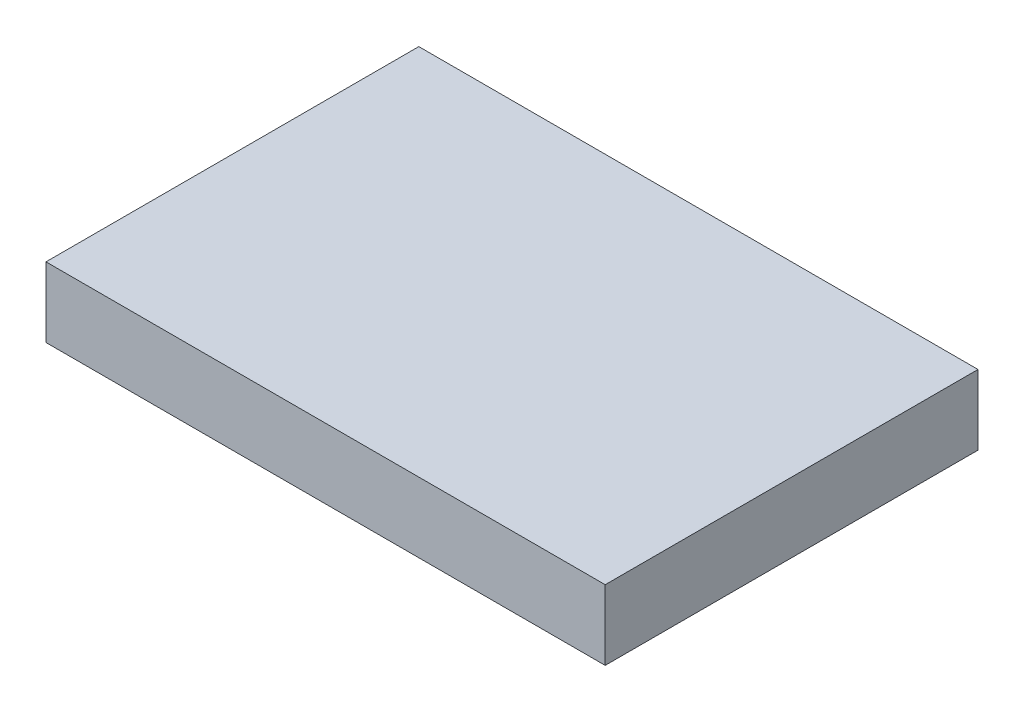
from build123d import *

# Parameters (mm, degrees)
SKETCH1_W           = 12
SKETCH1_H           = 8
BOSS_EXTRUDE1_DEPTH = 1.5


with BuildPart() as part:
    # Sketch1 → Boss-Extrude1 (new body)
    with BuildSketch(Plane(origin=(0, 0, 0), x_dir=(1, 0, 0), z_dir=(0, 1, 0))):
        with Locations((6, 4)):
            Rectangle(SKETCH1_W, SKETCH1_H)
    extrude(amount=BOSS_EXTRUDE1_DEPTH)


solid = part.part
